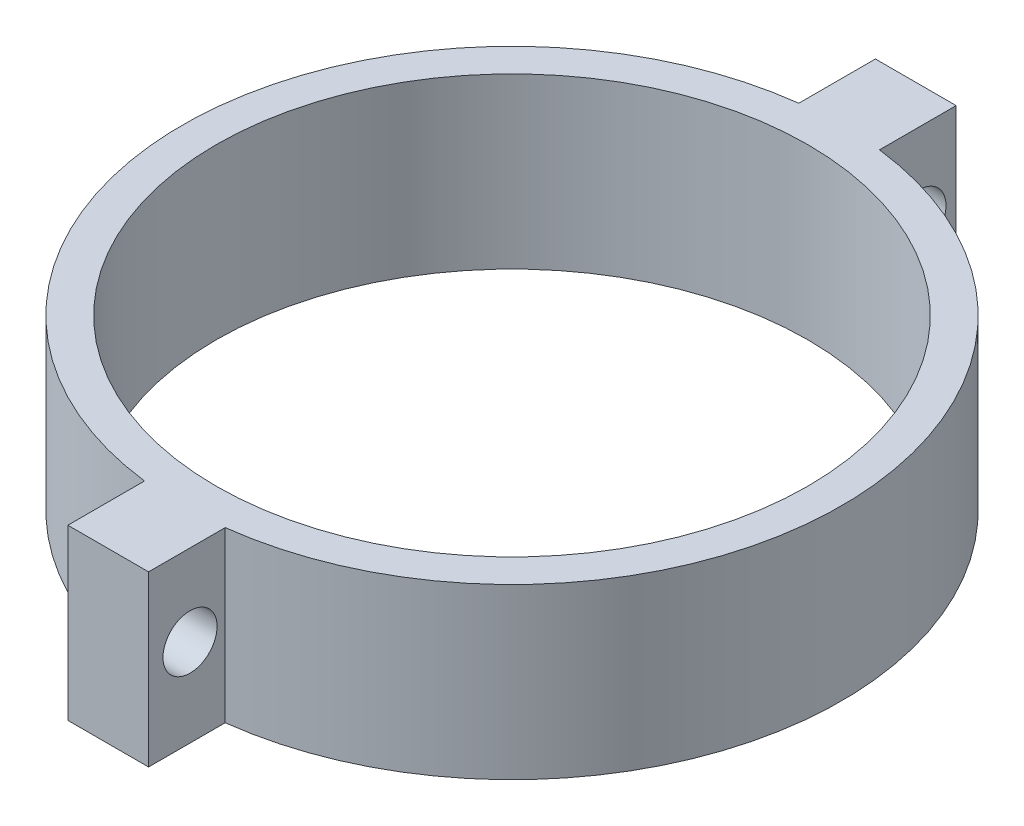
from build123d import *

# Parameters (mm, degrees)
SKETCH2_R           = 19.5
SKETCH2_R_2         = 17.5
BOSS_EXTRUDE2_DEPTH = 10
SKETCH3_R           = 1.6
CUT_EXTRUDE1_DEPTH  = 10


with BuildPart() as part:
    # Sketch2 → Boss-Extrude2 (new body)
    # profile 1 of 3: a face of its own
    with BuildSketch(Plane(origin=(0, 0, 0), x_dir=(1, 0, 0), z_dir=(0, 1, 0))):
        Circle(SKETCH2_R)
        with Locations(Location((0, 0, 0), (0, 0, 270))):
            Circle(SKETCH2_R_2, mode=Mode.SUBTRACT)
    # profile 2 of 3: a face of its own
    with BuildSketch(Plane(origin=(0, 0, 0), x_dir=(1, 0, 0), z_dir=(0, 1, 0))):
        with BuildLine():
            ThreePointArc((-2.387522163, 19.353287522), (0, 19.5), (2.387522163, 19.353287522))
            Line((2.387522163, 19.353287522), (2.387522163, 23.886441242))
            Line((2.387522163, 23.886441242), (-2.387522163, 23.886441242))
            Line((-2.387522163, 23.886441242), (-2.387522163, 19.353287522))
        make_face()
    # profile 3 of 3: a face of its own
    with BuildSketch(Plane(origin=(0, 0, 0), x_dir=(1, 0, 0), z_dir=(0, 1, 0))):
        with BuildLine():
            Line((2.387522163, -23.886441242), (2.387522163, -19.353287522))
            ThreePointArc((2.387522163, -19.353287522), (0, -19.5), (-2.387522163, -19.353287522))
            Line((-2.387522163, -19.353287522), (-2.387522163, -23.886441242))
            Line((-2.387522163, -23.886441242), (2.387522163, -23.886441242))
        make_face()
    extrude(amount=BOSS_EXTRUDE2_DEPTH)

    # Sketch3 → Cut-Extrude1 (cut)
    with BuildSketch(Plane.ZY.offset(2.387522163)):
        with Locations((-21.687379423, 5.18275768)):
            Circle(SKETCH3_R)
        with Locations((21.434001351, 5.18275768)):
            Circle(SKETCH3_R)
    extrude(amount=-CUT_EXTRUDE1_DEPTH, mode=Mode.SUBTRACT)


solid = part.part
